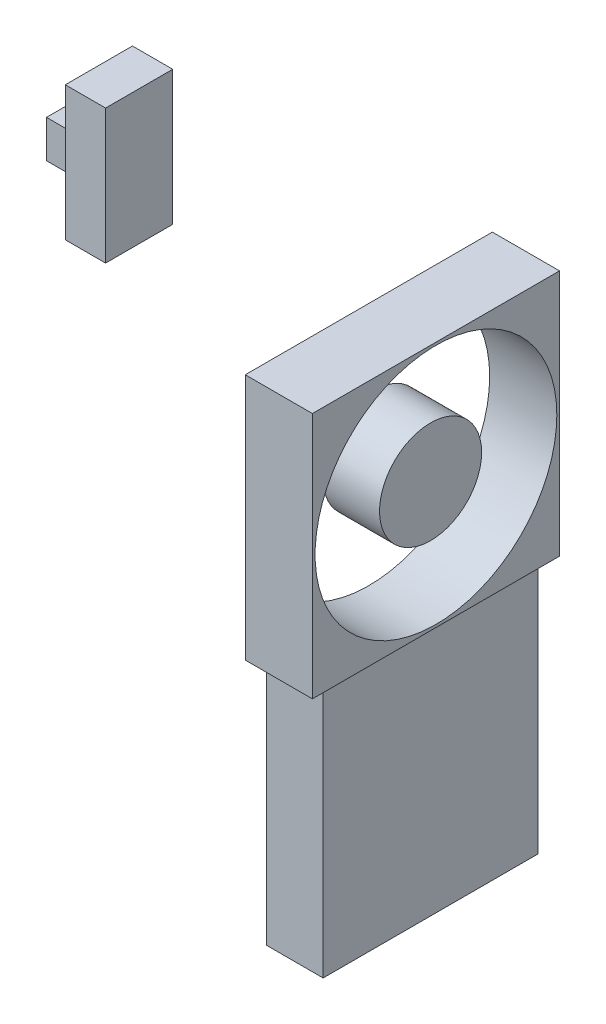
from build123d import *

# Parameters (mm, degrees)
FRAME_START         = 158
SKETCH1_W           = 92
SKETCH1_H           = 92
FRAME_DEPTH         = 25
BORE_START          = 157
SKETCH2_R           = 45
BORE_DEPTH          = 27
HUB_START           = 160
SKETCH3_R           = 19
HUB_DEPTH           = 21
FAN_STAND_START     = 160
SKETCH4_W           = 80
SKETCH4_H           = 94
FAN_STAND_DEPTH     = 21
BLOWER_50MM_START   = 95
SKETCH5_W           = 25
SKETCH5_H           = 50
BLOWER_50MM_DEPTH   = 15
BLOWER_NOZZLE_START = 80
SKETCH6_W           = 11
SKETCH6_H           = 14
BLOWER_NOZZLE_DEPTH = 15


with BuildPart() as part:
    # Sketch1 → frame (new body)
    with BuildSketch(Plane(origin=(0, 0, 0), x_dir=(0, 0, -1), z_dir=(1, 0, 0)).offset(FRAME_START)):
        with Locations((0, 140)):
            Rectangle(SKETCH1_W, SKETCH1_H)
    extrude(amount=FRAME_DEPTH)


with BuildPart() as body_2:
    # Sketch2 → bore (new body)
    with BuildSketch(Plane(origin=(0, 0, 0), x_dir=(0, 0, -1), z_dir=(1, 0, 0)).offset(BORE_START)):
        with Locations((0, 140)):
            Circle(SKETCH2_R)
    extrude(amount=BORE_DEPTH)


with BuildPart() as part_1:
    add(part.part)

    # Combine1: cut body 2
    add(body_2.part, mode=Mode.SUBTRACT)


with BuildPart() as body_2_2:
    # Sketch3 → hub (new body)
    with BuildSketch(Plane(origin=(0, 0, 0), x_dir=(0, 0, -1), z_dir=(1, 0, 0)).offset(HUB_START)):
        with Locations((0, 140)):
            Circle(SKETCH3_R)
    extrude(amount=HUB_DEPTH)


with BuildPart() as body_3:
    # Sketch4 → fan_stand (new body)
    with BuildSketch(Plane(origin=(0, 0, 0), x_dir=(0, 0, -1), z_dir=(1, 0, 0)).offset(FAN_STAND_START)):
        with Locations((0, 47)):
            Rectangle(SKETCH4_W, SKETCH4_H)
    extrude(amount=FAN_STAND_DEPTH)


with BuildPart() as body_4:
    # Sketch5 → blower_50mm (new body)
    with BuildSketch(Plane(origin=(0, 0, 0), x_dir=(0, 0, -1), z_dir=(1, 0, 0)).offset(BLOWER_50MM_START)):
        with Locations((-37.5, 225)):
            Rectangle(SKETCH5_W, SKETCH5_H)
    extrude(amount=BLOWER_50MM_DEPTH)


with BuildPart() as body_5:
    # Sketch6 → blower_nozzle (new body)
    with BuildSketch(Plane(origin=(0, 0, 0), x_dir=(0, 0, -1), z_dir=(1, 0, 0)).offset(BLOWER_NOZZLE_START)):
        with Locations((-36.5, 221)):
            Rectangle(SKETCH6_W, SKETCH6_H)
    extrude(amount=BLOWER_NOZZLE_DEPTH)


solid = Compound([part_1.part, body_2_2.part, body_3.part, body_4.part, body_5.part])
